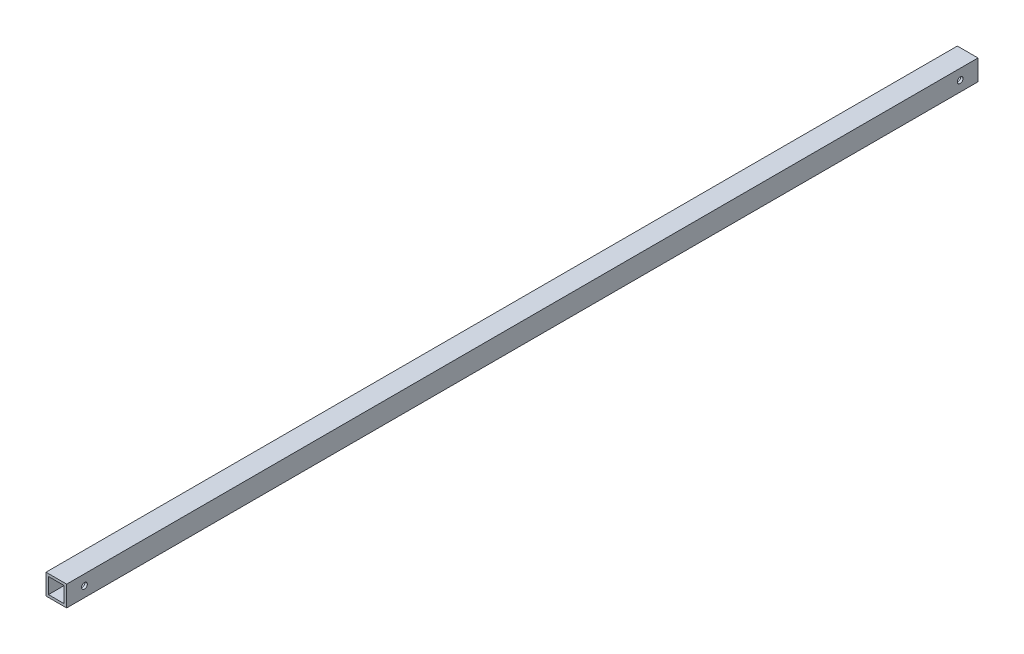
from build123d import *

# Parameters (mm, degrees)
SKETCH_1_W             = 25
SKETCH_1_H             = 25
SKETCH_1_W_2           = 19
SKETCH_1_H_2           = 19
EXTRUDE_1_DEPTH        = 1102.75
PATTERN_LINEAR_1_COUNT = 2
PATTERN_LINEAR_1_PITCH = 1059.69


with BuildPart() as part:
    # 草图1 → 拉伸1 (new body)
    with BuildSketch(Plane.XY):
        with Locations((12.5, -12.5)):
            Rectangle(SKETCH_1_W, SKETCH_1_H)
        with Locations((12.5, -12.5)):
            Rectangle(SKETCH_1_W_2, SKETCH_1_H_2, mode=Mode.SUBTRACT)
    extrude(amount=EXTRUDE_1_DEPTH)

    # 草图4 → Ø7.0 (7) 直径孔1 (revolve, cut)
    with BuildSketch(Plane(origin=(0, -12.5, 1081.25), x_dir=(0, 0, 1), z_dir=(0, 1, 0))):
        Polygon((0, 0), (0, 32.103012167), (3.5, 30), (3.5, 0), align=None)
    hole_wizard_7_0_7_1 = revolve(axis=Axis((-6.35, -12.5, 1081.25), (1, 0, 0)), mode=Mode.SUBTRACT)

    # 阵列(线性)1: Ø7.0 (7) 直径孔1 ×2
    with Locations(*[(0, 0, -i * PATTERN_LINEAR_1_PITCH) for i in range(1, PATTERN_LINEAR_1_COUNT)]):
        add(hole_wizard_7_0_7_1, mode=Mode.SUBTRACT)


solid = part.part
